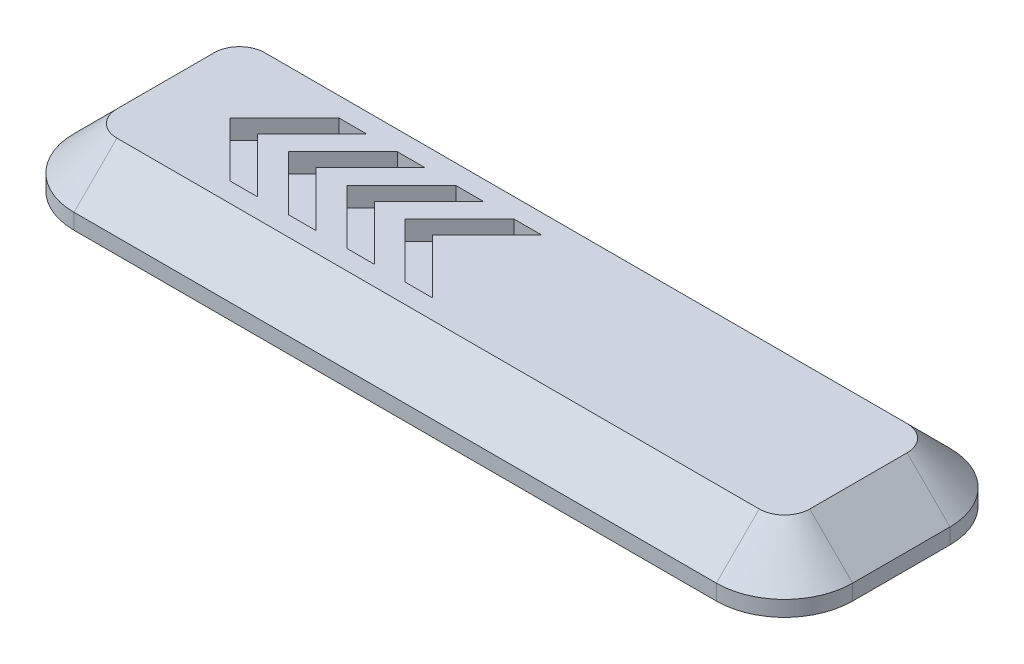
from build123d import *

# Parameters (mm, degrees)
BOSS_EXTRUDE1_DEPTH = 3
CHAMFER1_SIZE       = 2.2
BOSS_EXTRUDE2_DEPTH = 3
CUT_EXTRUDE1_DEPTH  = 1
CUT_EXTRUDE2_DEPTH  = 5
FILLET1_R           = 1


with BuildPart() as part:
    # Sketch1 → Boss-Extrude1 (new body)
    with BuildSketch(Plane(origin=(0, 0, 0), x_dir=(1, 0, 0), z_dir=(0, 1, 0))):
        with BuildLine():
            Line((24, -8.5), (33, -8.5))
            ThreePointArc((33, -8.5), (35.474873734, -7.474873734), (36.5, -5))
            Line((36.5, -5), (36.5, 0))
            ThreePointArc((36.5, 0), (35.474873734, 2.474873734), (33, 3.5))
            Line((33, 3.5), (24, 3.5))
            Line((24, 3.5), (0, 3.5))
            ThreePointArc((0, 3.5), (-2.474873734, 2.474873734), (-3.5, 0))
            Line((-3.5, 0), (-3.5, -5))
            ThreePointArc((-3.5, -5), (-2.474873734, -7.474873734), (0, -8.5))
            Line((0, -8.5), (24, -8.5))
        make_face()
    extrude(amount=BOSS_EXTRUDE1_DEPTH)

    # Chamfer1
    chamfer1_edges = [part.edges().sort_by_distance(p)[0] for p in [
        (-3.5, 3, 2.5),
        (-2.474873734, 3, 7.474873734),
        (16.5, 3, 8.5),
        (35.474873734, 3, 7.474873734),
        (36.5, 3, 2.5),
        (35.474873734, 3, -2.474873734),
        (16.5, 3, -3.5),
        (-2.474873734, 3, -2.474873734),
    ]]
    chamfer(chamfer1_edges, length=CHAMFER1_SIZE)

    # Sketch2 → Boss-Extrude2 (add)
    with BuildSketch(Plane.XZ):
        with BuildLine():
            Line((13.5, 5.5), (18.5, 5.5))
            ThreePointArc((18.5, 5.5), (19.560660172, 5.060660172), (20, 4))
            Line((20, 4), (20, 1))
            ThreePointArc((20, 1), (19.560660172, -0.060660172), (18.5, -0.5))
            Line((18.5, -0.5), (13.5, -0.5))
            ThreePointArc((13.5, -0.5), (12.439339828, -0.060660172), (12, 1))
            Line((12, 1), (12, 4))
            ThreePointArc((12, 4), (12.439339828, 5.060660172), (13.5, 5.5))
        make_face()
    extrude(amount=BOSS_EXTRUDE2_DEPTH)

    # Sketch3 → Cut-Extrude1 (cut)
    with BuildSketch(Plane(origin=(0, 3, 0), x_dir=(1, 0, 0), z_dir=(0, 1, 0))):
        Polygon((6.225775105, 0.3), (4.811561543, 0.3), (2.011561543, -2.5), (4.811561543, -5.3), (6.225775105, -5.3), (3.425775105, -2.5), align=None)
        Polygon((9.225775105, 0.3), (7.811561543, 0.3), (5.011561543, -2.5), (7.811561543, -5.3), (9.225775105, -5.3), (6.425775105, -2.5), align=None)
        Polygon((12.225775105, 0.3), (10.811561543, 0.3), (8.011561543, -2.5), (10.811561543, -5.3), (12.225775105, -5.3), (9.425775105, -2.5), align=None)
        Polygon((15.225775105, 0.3), (13.811561543, 0.3), (11.011561543, -2.5), (13.811561543, -5.3), (15.225775105, -5.3), (12.425775105, -2.5), align=None)
    extrude(amount=-CUT_EXTRUDE1_DEPTH, mode=Mode.SUBTRACT)

    # Sketch4 → Cut-Extrude2 (cut)
    with BuildSketch(Plane.ZY.offset(-12)):
        Polygon((1.5, -3), (1, -1.5), (1, 0), (4, 0), (4, -1.5), (3.5, -3), align=None)
    extrude(amount=-CUT_EXTRUDE2_DEPTH, mode=Mode.SUBTRACT)

    # Fillet1
    fillet1_edges = [part.edges().sort_by_distance(p)[0] for p in [
        (12.439339828, 0, 5.060660172),
        (12.439339828, 0, -0.060660172),
        (16, 0, -0.5),
        (19.560660172, 0, -0.060660172),
        (20, 0, 2.5),
        (19.560660172, 0, 5.060660172),
        (16, 0, 5.5),
    ]]
    fillet(fillet1_edges, radius=FILLET1_R)


solid = part.part
